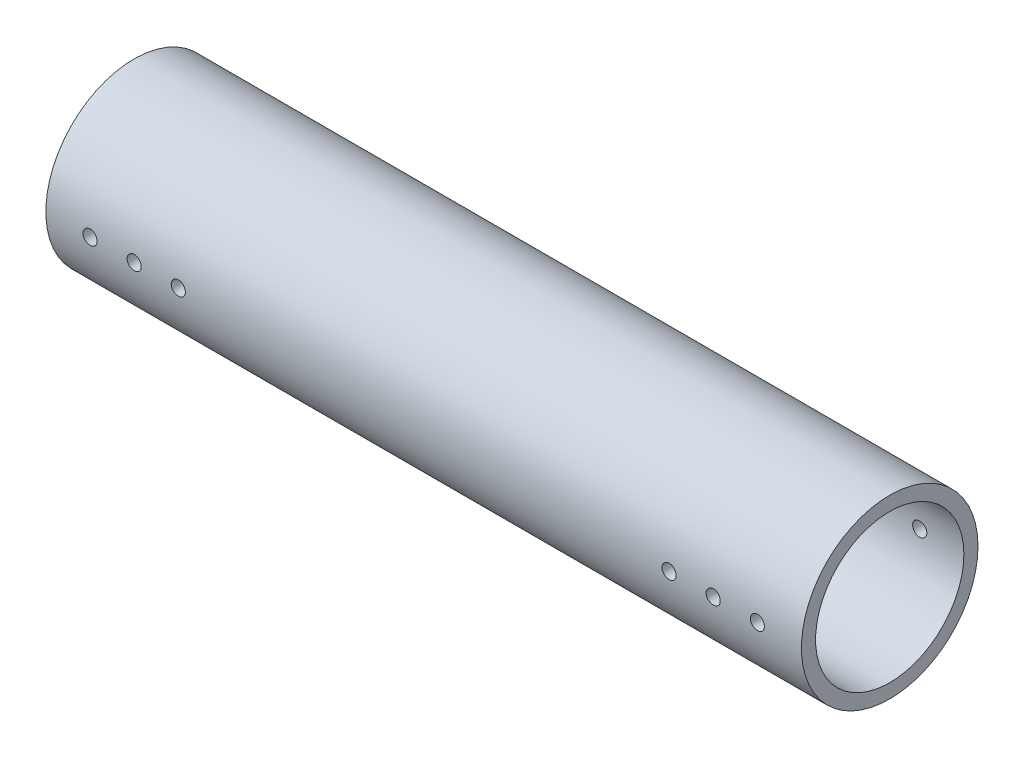
from build123d import *

# Parameters (mm, degrees)
SKETCH_2_R               = 25
SKETCH_2_R_2             = 21
EXTRUDE_2_DEPTH          = 214
CUT_EXTRUDE_2_DEPTH      = 10
CUT_EXTRUDE_2_DEPTH_BACK = 222.18092142
SKETCH_4_R               = 2


with BuildPart() as part:
    # Эскиз2 → Бобышка-Вытянуть2 (new body)
    with BuildSketch(Plane(origin=(0, 0, 0), x_dir=(0, 0, -1), z_dir=(1, 0, 0))):
        Circle(SKETCH_2_R)
        Circle(SKETCH_2_R_2, mode=Mode.SUBTRACT)
    extrude(amount=EXTRUDE_2_DEPTH)

    # Эскиз4 → Вырез-Вытянуть2 (cut, two sides: drawn at the far end of the back side and taken through both)
    with BuildSketch(Plane.XY.offset(25).offset(-CUT_EXTRUDE_2_DEPTH_BACK)):
        with Locations((12.5, 0)):
            Circle(SKETCH_4_R)
        with Locations((201.5, 0)):
            Circle(SKETCH_4_R)
        with Locations((25, 0)):
            Circle(SKETCH_4_R)
        with Locations((37.5, 0)):
            Circle(SKETCH_4_R)
        with Locations((189, 0)):
            Circle(SKETCH_4_R)
        with Locations((176.5, 0)):
            Circle(SKETCH_4_R)
    extrude(amount=CUT_EXTRUDE_2_DEPTH + CUT_EXTRUDE_2_DEPTH_BACK, mode=Mode.SUBTRACT)


solid = part.part
